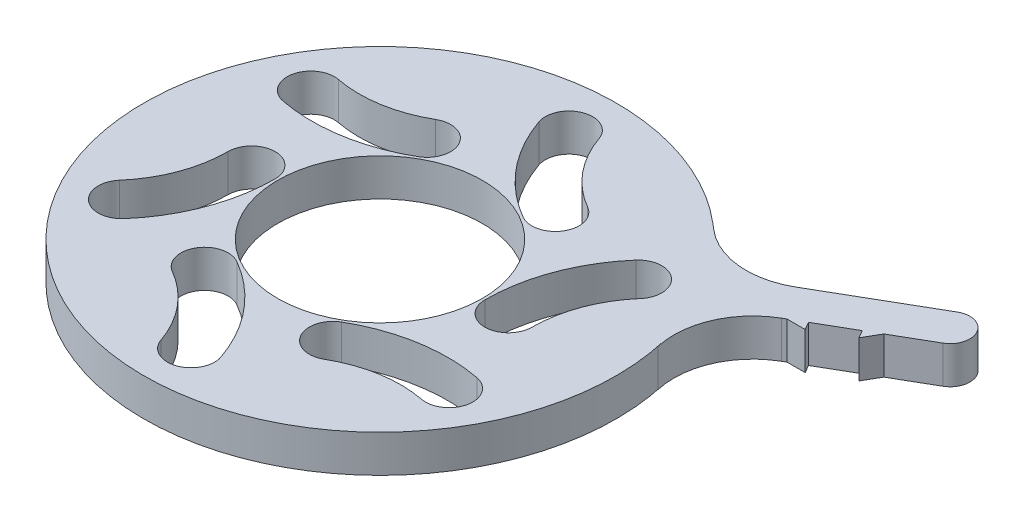
from build123d import *

# Parameters (mm, degrees)
ESQUISSE1_R        = 30
ESQUISSE1_R_2      = 13
BOSS_EXTRU_1_DEPTH = 4.75
BOSS_EXTRU_2_START = -4.75
BOSS_EXTRU_2_DEPTH = 4.75
BOSS_EXTRU_3_DEPTH = 4.75


with BuildPart() as part:
    # Esquisse1 → Boss.-Extru.1 (new body)
    with BuildSketch(Plane(origin=(0, 0, 0), x_dir=(1, 0, 0), z_dir=(0, 1, 0))):
        with Locations(Location((0, 0, 0), (0, 0, 270))):
            Circle(ESQUISSE1_R)
        with Locations(Location((0, 0, 0), (0, 0, 270))):
            Circle(ESQUISSE1_R_2, mode=Mode.SUBTRACT)
        with BuildLine():
            ThreePointArc((-2.834733548, 23.018019494), (0.874151367, 16.41695293), (6.655356686, 11.527415922))
            ThreePointArc((6.655356686, 11.527415922), (10.753432897, 12.625492134), (9.655356686, 16.723568345))
            ThreePointArc((9.655356686, 16.723568345), (5.500346376, 20.237727687), (2.834733548, 24.981980506))
            ThreePointArc((2.834733548, 24.981980506), (-0.981980506, 26.834733548), (-2.834733548, 23.018019494))
        make_face(mode=Mode.SUBTRACT)
        with BuildLine():
            ThreePointArc((23.052396529, 10.036038988), (22.748570703, 14.267786838), (18.516822853, 13.963961012))
            ThreePointArc((18.516822853, 13.963961012), (14.654573974, 7.451439174), (13.310713372, 0))
            ThreePointArc((13.310713372, 0), (16.310713372, -3), (19.310713372, 0))
            ThreePointArc((19.310713372, 0), (20.27655948, 5.355424153), (23.052396529, 10.036038988))
        make_face(mode=Mode.SUBTRACT)
        with BuildLine():
            ThreePointArc((20.217662981, -14.945941518), (23.730551209, -12.56694671), (21.3515564, -9.054058482))
            ThreePointArc((21.3515564, -9.054058482), (13.780422607, -8.965513756), (6.655356686, -11.527415922))
            ThreePointArc((6.655356686, -11.527415922), (5.557280474, -15.625492134), (9.655356686, -16.723568345))
            ThreePointArc((9.655356686, -16.723568345), (14.776213104, -14.882303535), (20.217662981, -14.945941518))
        make_face(mode=Mode.SUBTRACT)
        with BuildLine():
            ThreePointArc((-2.834733548, -24.981980506), (0.981980506, -26.834733548), (2.834733548, -23.018019494))
            ThreePointArc((2.834733548, -23.018019494), (-0.874151367, -16.41695293), (-6.655356686, -11.527415922))
            ThreePointArc((-6.655356686, -11.527415922), (-10.753432897, -12.625492134), (-9.655356686, -16.723568345))
            ThreePointArc((-9.655356686, -16.723568345), (-5.500346376, -20.237727687), (-2.834733548, -24.981980506))
        make_face(mode=Mode.SUBTRACT)
        with BuildLine():
            ThreePointArc((-23.052396529, -10.036038988), (-22.748570703, -14.267786838), (-18.516822853, -13.963961012))
            ThreePointArc((-18.516822853, -13.963961012), (-14.654573974, -7.451439174), (-13.310713372, 0))
            ThreePointArc((-13.310713372, 0), (-16.310713372, 3), (-19.310713372, 0))
            ThreePointArc((-19.310713372, 0), (-20.27655948, -5.355424153), (-23.052396529, -10.036038988))
        make_face(mode=Mode.SUBTRACT)
        with BuildLine():
            ThreePointArc((-20.217662981, 14.945941518), (-23.730551209, 12.56694671), (-21.3515564, 9.054058482))
            ThreePointArc((-21.3515564, 9.054058482), (-13.780422607, 8.965513756), (-6.655356686, 11.527415922))
            ThreePointArc((-6.655356686, 11.527415922), (-5.557280474, 15.625492134), (-9.655356686, 16.723568345))
            ThreePointArc((-9.655356686, 16.723568345), (-14.776213104, 14.882303535), (-20.217662981, 14.945941518))
        make_face(mode=Mode.SUBTRACT)
    extrude(amount=BOSS_EXTRU_1_DEPTH)

    # Esquisse2 → Boss.-Extru.2 (add)
    with BuildSketch(Plane(origin=(0, 4.75, 0), x_dir=(1, 0, 0), z_dir=(0, 1, 0)).offset(BOSS_EXTRU_2_START)):
        with BuildLine():
            Line((19.448716719, 22.841791041), (20.183832184, 22.215874605))
            ThreePointArc((20.183832184, 22.215874605), (25.759295996, 19.87106259), (31.666737758, 21.169550915))
            Line((31.666737758, 21.169550915), (44.657118814, 28.669550915))
            ThreePointArc((44.657118814, 28.669550915), (48.072182324, 27.754487405), (47.157118814, 24.339423896))
            Line((47.157118814, 24.339423896), (34.166737758, 16.839423896))
            ThreePointArc((34.166737758, 16.839423896), (29.989946446, 12.152392884), (29.430081471, 5.899361893))
            Line((29.430081471, 5.899361893), (29.20996886, 6.839423896))
            ThreePointArc((29.20996886, 6.839423896), (25.611244779, 15.622552316), (19.448716719, 22.841791041))
        make_face()
    extrude(amount=BOSS_EXTRU_2_DEPTH)

    # Esquisse3 → Boss.-Extru.3 (add)
    with BuildSketch(Plane(origin=(0, 4.75, 0), x_dir=(1, 0, 0), z_dir=(0, 1, 0))):
        Polygon((34.599750459, 17.089423896), (36.909151536, 17.089423896), (36.331801267, 18.089423896), align=None)
        Polygon((40.661928286, 20.589423896), (42.393979093, 21.589423896), (41.239278555, 19.589423896), align=None)
    extrude(amount=-BOSS_EXTRU_3_DEPTH)


solid = part.part
